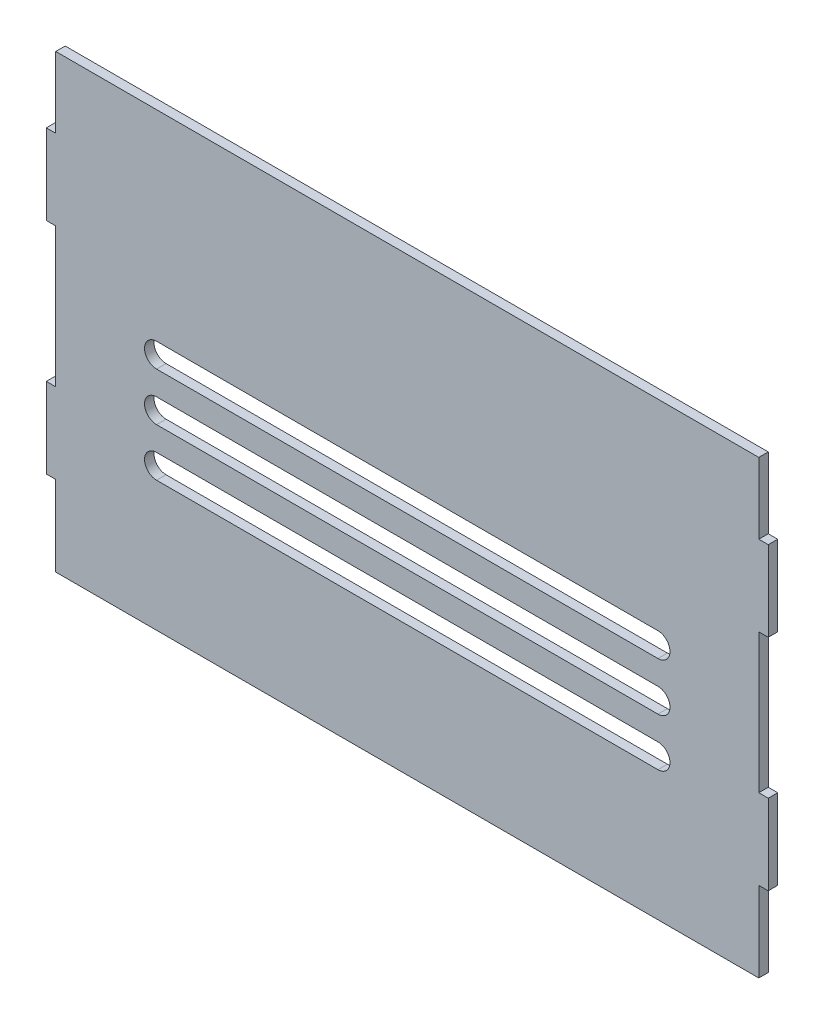
from build123d import *

# Parameters (mm, degrees)
BOSS_EXTRUDE1_DEPTH = 2.3622
CUT_EXTRUDE1_DEPTH  = 124.949730405


with BuildPart() as part:
    # Sketch1 → Boss-Extrude1 (new body)
    with BuildSketch(Plane.XY):
        Polygon((-77.381787364, 72.847015101), (-77.381787364, 55.177029121), (-79.743987364, 55.177029121), (-79.743987364, 35.177029121), (-77.381787364, 35.177029121), (-77.381787364, 0.437015101), (-79.743987364, 0.437015101), (-79.743987364, -19.562984899), (-77.381787364, -19.562984899), (-77.381787364, -39.562984899), (97.893812636, -39.562984899), (97.893812636, -19.562984899), (100.256012636, -19.562984899), (100.256012636, 0.437015101), (97.893812636, 0.437015101), (97.893812636, 35.177029121), (100.256012636, 35.177029121), (100.256012636, 55.177029121), (97.893812636, 55.177029121), (97.893812636, 72.847015101), align=None)
    extrude(amount=BOSS_EXTRUDE1_DEPTH)

    # Sketch2 → Cut-Extrude1 (cut, through all)
    with BuildSketch(Plane.XY.offset(2.3622)):
        with BuildLine():
            Line((-52.243987364, 22.847015101), (72.756012636, 22.847015101))
            ThreePointArc((72.756012636, 22.847015101), (75.756012636, 19.847015101), (72.756012636, 16.847015101))
            Line((72.756012636, 16.847015101), (-52.243987364, 16.847015101))
            ThreePointArc((-52.243987364, 16.847015101), (-55.243987364, 19.847015101), (-52.243987364, 22.847015101))
        make_face()
        with BuildLine():
            Line((-52.243987364, 10.847015101), (72.756012636, 10.847015101))
            ThreePointArc((72.756012636, 10.847015101), (75.756012636, 7.847015101), (72.756012636, 4.847015101))
            Line((72.756012636, 4.847015101), (-52.243987364, 4.847015101))
            ThreePointArc((-52.243987364, 4.847015101), (-55.243987364, 7.847015101), (-52.243987364, 10.847015101))
        make_face()
        with BuildLine():
            Line((-52.243987364, -1.152984899), (72.756012636, -1.152984899))
            ThreePointArc((72.756012636, -1.152984899), (75.756012636, -4.152984899), (72.756012636, -7.152984899))
            Line((72.756012636, -7.152984899), (-52.243987364, -7.152984899))
            ThreePointArc((-52.243987364, -7.152984899), (-55.243987364, -4.152984899), (-52.243987364, -1.152984899))
        make_face()
    extrude(amount=-CUT_EXTRUDE1_DEPTH, mode=Mode.SUBTRACT)


solid = part.part
